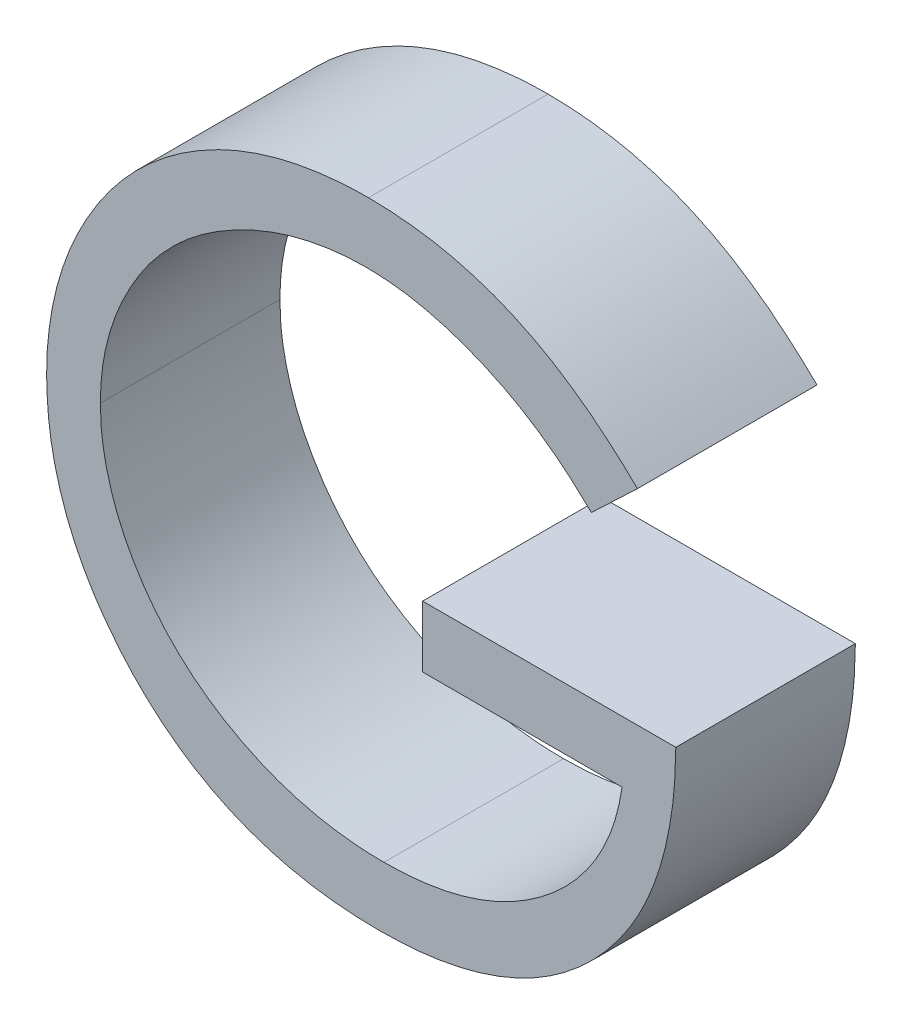
from build123d import *

# Parameters (mm, degrees)
BOSS_EXTRU_1_DEPTH = 1.5


with BuildPart() as part:
    # Esquisse1 → Boss.-Extru.1 (new body)
    with BuildSketch(Plane.XY):
        with BuildLine():
            Line((-50.752978146, -18.723484461), (-51.137593531, -19.088067794))
            add(Edge.make_bspline(
                [(-51.137593531, -19.088067794), (-51.207191943, -19.022595133), (-51.344729152, -18.893211043), (-51.56895807, -18.725338193), (-51.802906119, -18.581529478), (-52.045352543, -18.464520569), (-52.290293334, -18.371159483), (-52.5344773, -18.304690711), (-52.775399731, -18.262301372), (-52.935638614, -18.257232272), (-53.014596736, -18.254734461)],
                knots=[0, 0, 0, 0, 1.08915593, 2.152340314, 3.188132944, 4.216796309, 5.218260357, 6.173443236, 7.099959455, 8, 8, 8, 8], degree=3))
            add(Edge.make_bspline(
                [(-53.014596736, -18.254734461), (-53.063046307, -18.255325326), (-53.159819794, -18.256505525), (-53.303565428, -18.27156869), (-53.445803481, -18.293232781), (-53.586265445, -18.324578321), (-53.725224426, -18.364305549), (-53.862197129, -18.413999068), (-53.997439064, -18.471935131), (-54.129676323, -18.538881522), (-54.257877042, -18.61242416), (-54.378958236, -18.693922075), (-54.493691663, -18.780763203), (-54.599920842, -18.875121745), (-54.698256823, -18.976142981), (-54.791040211, -19.081947704), (-54.875007777, -19.195426588), (-54.950852298, -19.314491768), (-55.018511753, -19.437052039), (-55.078238401, -19.561927738), (-55.128377098, -19.688704673), (-55.168047749, -19.817541927), (-55.200777254, -19.94744277), (-55.223802408, -20.079306656), (-55.236783439, -20.213274778), (-55.239028839, -20.302985147), (-55.240157634, -20.34808382)],
                knots=[0, 0, 0, 0, 1.02818874, 2.053710826, 3.065248034, 4.081641283, 5.106893873, 6.131558223, 7.173050175, 8.228653731, 9.27666206, 10.308777013, 11.325269123, 12.329503258, 13.32196095, 14.316845687, 15.314881793, 16.315733098, 17.311955233, 18.285320748, 19.252783886, 20.203351036, 21.145449891, 22.095197417, 23.042428769, 24, 24, 24, 24], degree=3))
            add(Edge.make_bspline(
                [(-55.240157634, -20.34808382), (-55.239078036, -20.394184987), (-55.236921789, -20.486261435), (-55.223121332, -20.623681539), (-55.19750956, -20.759060685), (-55.163269976, -20.892843733), (-55.12044024, -21.025259801), (-55.067050717, -21.155734815), (-55.003814145, -21.284263945), (-54.93061907, -21.409689112), (-54.850353065, -21.53186486), (-54.760434378, -21.646949891), (-54.664919259, -21.756476716), (-54.560327973, -21.858013521), (-54.450014342, -21.95427623), (-54.330682519, -22.04261269), (-54.204679004, -22.124724438), (-54.071811558, -22.199576608), (-53.933521869, -22.266445945), (-53.791726508, -22.325908654), (-53.645972485, -22.374879135), (-53.497025786, -22.414790713), (-53.345063969, -22.447505423), (-53.189315679, -22.468551823), (-53.030926096, -22.483824439), (-52.924156622, -22.48494111), (-52.870365967, -22.485503692)],
                knots=[0, 0, 0, 0, 0.93586088, 1.869166235, 2.799637598, 3.729985548, 4.670839027, 5.622275134, 6.589130586, 7.576015415, 8.568469353, 9.55398029, 10.53834874, 11.515998671, 12.510579167, 13.508179873, 14.527009472, 15.561807829, 16.601455013, 17.643573243, 18.680854198, 19.719860599, 20.772568776, 21.833555941, 22.908541556, 24, 24, 24, 24], degree=3))
            add(Edge.make_bspline(
                [(-52.870365967, -22.485503692), (-52.805539757, -22.484148583), (-52.67824296, -22.481487606), (-52.491119471, -22.460772907), (-52.311400798, -22.428420344), (-52.139591937, -22.381040492), (-51.975493336, -22.320606671), (-51.818503419, -22.247756118), (-51.669858193, -22.159694605), (-51.529110802, -22.060303367), (-51.39945768, -21.949567892), (-51.282523217, -21.830075813), (-51.180172518, -21.702407146), (-51.090880091, -21.567313839), (-51.017010584, -21.423677689), (-50.95637802, -21.2722026), (-50.909901889, -21.11282044), (-50.890823354, -21.002689537), (-50.881183275, -20.947042153)],
                knots=[0, 0, 0, 0, 1.13008108, 2.219097802, 3.278683437, 4.311054135, 5.322181354, 6.324827112, 7.324222904, 8.330512327, 9.32562643, 10.293043162, 11.24128371, 12.174520618, 13.111833804, 14.052305215, 15.015860969, 16, 16, 16, 16], degree=3))
            Line((-50.881183275, -20.947042153), (-52.547849941, -20.947042153))
            Line((-52.547849941, -20.947042153), (-52.547849941, -20.43422164))
            Line((-52.547849941, -20.43422164), (-50.432465326, -20.43422164))
            add(Edge.make_bspline(
                [(-50.432465326, -20.43422164), (-50.434902252, -20.529803767), (-50.439671757, -20.716875255), (-50.473127351, -20.989689928), (-50.52715094, -21.247363776), (-50.600951385, -21.490168164), (-50.6964875, -21.717759011), (-50.812733969, -21.930367391), (-50.951551285, -22.126619792), (-51.107994773, -22.308118369), (-51.283566141, -22.470017243), (-51.473521313, -22.61231144), (-51.678174124, -22.732172319), (-51.897330992, -22.829687551), (-52.130274469, -22.905793258), (-52.377543583, -22.959752654), (-52.638803012, -22.992081173), (-52.817855408, -22.996211715), (-52.909428467, -22.998324204)],
                knots=[0, 0, 0, 0, 1.140356446, 2.231883559, 3.274166699, 4.278491846, 5.25512956, 6.21435461, 7.1637429, 8.11826594, 9.068280886, 10.0076534, 10.945064095, 11.891975133, 12.864533718, 13.863980011, 14.907571808, 16, 16, 16, 16], degree=3))
            add(Edge.make_bspline(
                [(-52.909428467, -22.998324204), (-52.965871517, -22.997511174), (-53.077195404, -22.995907616), (-53.241611016, -22.984511406), (-53.401493331, -22.966967725), (-53.556819058, -22.940474692), (-53.708159547, -22.908025186), (-53.854758954, -22.86647273), (-53.997175728, -22.818374588), (-54.135629993, -22.763666483), (-54.26886506, -22.700278402), (-54.39747437, -22.62983606), (-54.522168836, -22.552702688), (-54.642099071, -22.467544337), (-54.757889959, -22.374997965), (-54.868794878, -22.274878081), (-54.975434704, -22.167490767), (-55.042235366, -22.091235039), (-55.075894813, -22.052811384)],
                knots=[0, 0, 0, 0, 1.107784379, 2.184907829, 3.233506516, 4.263428166, 5.276301166, 6.270063455, 7.25232949, 8.225834625, 9.190232166, 10.146266622, 11.1027726, 12.066435141, 13.031522626, 14.010570082, 14.99756817, 16, 16, 16, 16], degree=3))
            add(Edge.make_bspline(
                [(-55.075894813, -22.052811384), (-55.124731859, -21.991853308), (-55.221595305, -21.870948998), (-55.346278386, -21.677234792), (-55.452566105, -21.476660706), (-55.53880585, -21.268668379), (-55.606145974, -21.053452361), (-55.654440621, -20.831287659), (-55.682736748, -20.601888187), (-55.68681323, -20.446652095), (-55.688875582, -20.368115871)],
                knots=[0, 0, 0, 0, 1.023165419, 2.029347347, 3.013907458, 3.994755782, 4.975994455, 5.96558838, 6.970761222, 8, 8, 8, 8], degree=3))
            add(Edge.make_bspline(
                [(-55.688875582, -20.368115871), (-55.688115242, -20.309306939), (-55.686604225, -20.192436499), (-55.668282059, -20.01892606), (-55.641994319, -19.8484965), (-55.60335567, -19.681287134), (-55.55464672, -19.517186289), (-55.493856026, -19.356117769), (-55.423077603, -19.197986524), (-55.340812609, -19.043880998), (-55.249263381, -18.895846122), (-55.149905923, -18.754477832), (-55.041329351, -18.622350596), (-54.925306781, -18.497791099), (-54.800453937, -18.382364174), (-54.667940475, -18.275001159), (-54.527664271, -18.175558037), (-54.379184014, -18.08560113), (-54.224715893, -18.004795958), (-54.064630177, -17.933954227), (-53.898975733, -17.875406633), (-53.728993622, -17.825729805), (-53.553397192, -17.78899389), (-53.373460711, -17.762352825), (-53.188246265, -17.744123397), (-53.063051938, -17.742657317), (-52.999572698, -17.741913948)],
                knots=[0, 0, 0, 0, 1.008945113, 2.00506715, 2.99143336, 3.967273523, 4.948097931, 5.927297278, 6.919902385, 7.919676788, 8.923139349, 9.905703106, 10.883022732, 11.856032218, 12.825136022, 13.798837087, 14.781400844, 15.773989409, 16.776158564, 17.77167057, 18.775803737, 19.789618931, 20.80898985, 21.851988756, 22.910860228, 24, 24, 24, 24], degree=3))
            add(Edge.make_bspline(
                [(-52.999572698, -17.741913948), (-52.947803778, -17.742741793), (-52.845152094, -17.744383313), (-52.692401048, -17.755761382), (-52.542011027, -17.773795498), (-52.393759042, -17.798405193), (-52.248149947, -17.831924751), (-52.104768939, -17.872036586), (-51.963408173, -17.91873919), (-51.824510674, -17.974437542), (-51.687142509, -18.037657006), (-51.550539879, -18.108819038), (-51.415169528, -18.189140473), (-51.280796697, -18.27885981), (-51.146574043, -18.376436121), (-51.014624554, -18.484660155), (-50.881763205, -18.599264092), (-50.796332042, -18.681667211), (-50.752978146, -18.723484461)],
                knots=[0, 0, 0, 0, 0.985871117, 1.954866573, 2.915460327, 3.869826059, 4.81536089, 5.759505086, 6.70452669, 7.649098992, 8.607881297, 9.583363685, 10.581137262, 11.603961102, 12.659522466, 13.73993555, 14.853081303, 16, 16, 16, 16], degree=3))
        make_face()
    extrude(amount=BOSS_EXTRU_1_DEPTH)


solid = part.part
